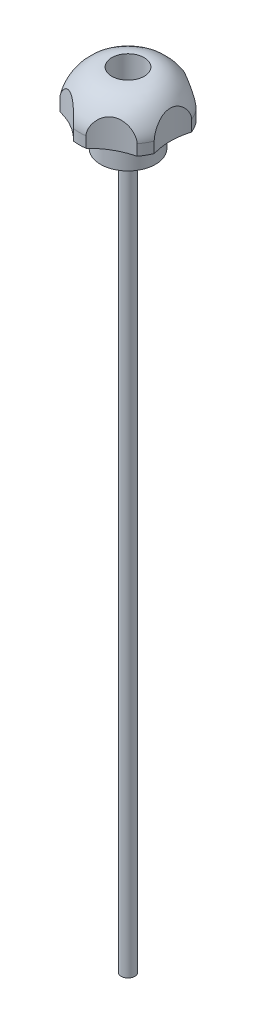
from build123d import *

# Parameters (mm, degrees)
CORTAR_EXTRUIR1_DEPTH = 345.174069344


with BuildPart() as part:
    # Croquis2 → Revolución1 (revolve)
    with BuildSketch(Plane.XY):
        with BuildLine():
            Line((3.175, 330), (12.7, 330))
            Line((12.7, 330), (12.7, 347.7))
            add(Edge.make_bspline(
                [(12.7, 347.7), (18.502741551, 347.7), (18.502741551, 342.7)],
                knots=[0, 0, 0, 1, 1, 1], degree=2))
            Line((18.502741551, 342.7), (22.5, 342.7))
            Line((22.5, 342.7), (22.5, 347.7))
            add(Edge.make_bspline(
                [(7.5, 362.7), (13.78939178, 362.7), (19.76753999, 357.472351461), (22.5, 349.738947382), (22.5, 347.7)],
                knots=[0, 0, 0, 0, 0.720044841, 1, 1, 1, 1], degree=3))
            Line((7.5, 362.7), (7.5, 350))
            Line((7.5, 350), (0, 350))
            Line((0, 350), (0, 0))
            Line((0, 0), (3.175, 0))
            Line((3.175, 0), (3.175, 330))
        make_face()
    revolve(axis=Axis((0, 0, 0), (0, 1, 0)))

    # Croquis3 → Cortar-Extruir1 (cut, through all)
    with BuildSketch(Plane.XZ.offset(-342.7)):
        with BuildLine():
            ThreePointArc((20.772727273, 8.645449766), (19.5, 0), (20.772727273, -8.645449766))
            ThreePointArc((20.772727273, -8.645449766), (22.5, 0), (20.772727273, 8.645449766))
        make_face()
        with BuildLine():
            ThreePointArc((17.873542761, -13.666984641), (9.75, -16.887495374), (2.899184512, -22.312434407))
            ThreePointArc((2.899184512, -22.312434407), (11.25, -19.485571585), (17.873542761, -13.666984641))
        make_face()
        with BuildLine():
            ThreePointArc((-2.899184512, -22.312434407), (-9.75, -16.887495374), (-17.873542761, -13.666984641))
            ThreePointArc((-17.873542761, -13.666984641), (-11.25, -19.485571585), (-2.899184512, -22.312434407))
        make_face()
        with BuildLine():
            ThreePointArc((-20.772727273, -8.645449766), (-19.5, 0), (-20.772727273, 8.645449766))
            ThreePointArc((-20.772727273, 8.645449766), (-22.5, 0), (-20.772727273, -8.645449766))
        make_face()
        with BuildLine():
            ThreePointArc((-17.873542761, 13.666984641), (-9.75, 16.887495374), (-2.899184512, 22.312434407))
            ThreePointArc((-2.899184512, 22.312434407), (-11.25, 19.485571585), (-17.873542761, 13.666984641))
        make_face()
        with BuildLine():
            ThreePointArc((2.899184512, 22.312434407), (9.75, 16.887495374), (17.873542761, 13.666984641))
            ThreePointArc((17.873542761, 13.666984641), (11.25, 19.485571585), (2.899184512, 22.312434407))
        make_face()
    extrude(amount=-CORTAR_EXTRUIR1_DEPTH, mode=Mode.SUBTRACT)


solid = part.part
